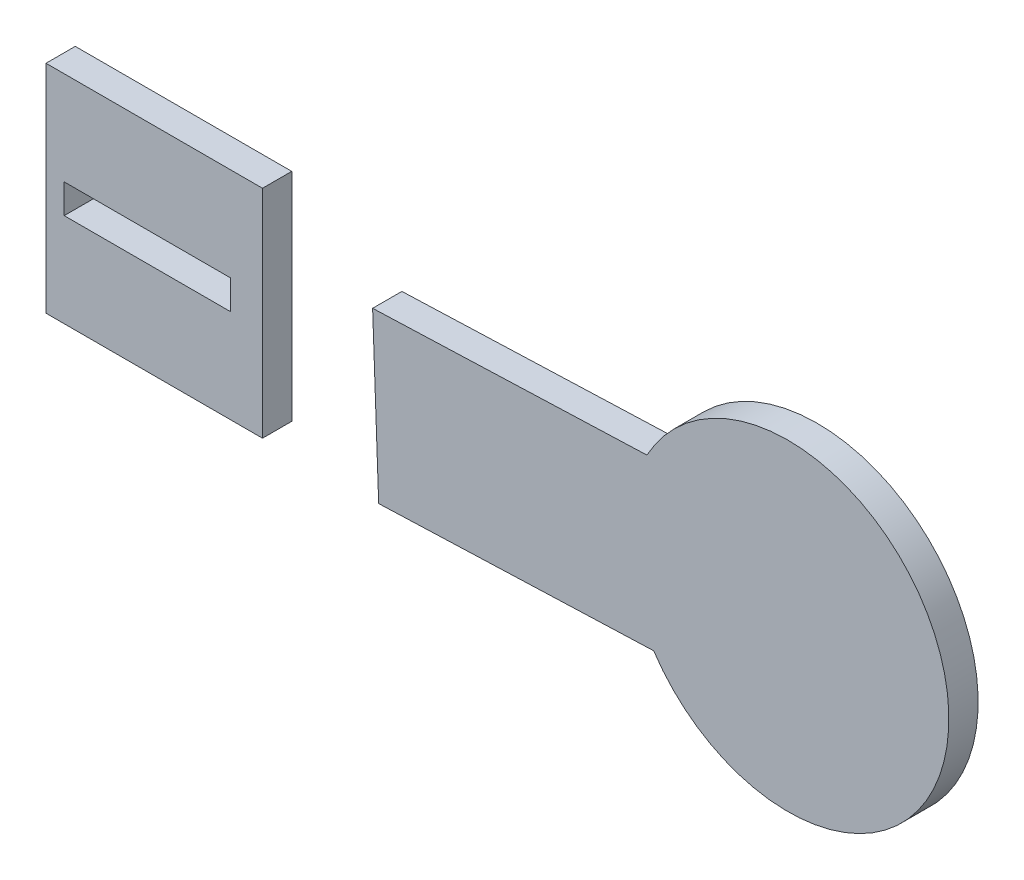
from build123d import *

# Parameters (mm, degrees)
ESQUISSE1_R        = 27.5
BOSS_EXTRU_1_DEPTH = 5
BOSS_EXTRU_2_START = -5
ESQUISSE2_W        = 37
ESQUISSE2_H        = 37
ESQUISSE2_W_2      = 28.39008226
ESQUISSE2_H_2      = 5
BOSS_EXTRU_2_DEPTH = 5


with BuildPart() as part:
    # Esquisse1 → Boss.-Extru.1 (new body)
    with BuildSketch(Plane.XY):
        with Locations((-60.40730743, 29.21875)):
            Circle(ESQUISSE1_R)
    extrude(amount=BOSS_EXTRU_1_DEPTH)

    # Esquisse2 → Boss.-Extru.2 (add)
    # profile 1 of 2: a face of its own
    with BuildSketch(Plane.XY.offset(5).offset(BOSS_EXTRU_2_START)):
        with BuildLine():
            Line((-83.35490173, 14.064281489), (-130.35490173, 12.348969386))
            Line((-130.35490173, 12.348969386), (-131.391026234, 40.739051645))
            Line((-131.391026234, 40.739051645), (-84.515157408, 42.449833457))
            ThreePointArc((-84.515157408, 42.449833457), (-32.930251562, 30.34187102), (-83.35490173, 14.064281489))
        make_face()
    # profile 2 of 2: a face of its own
    with BuildSketch(Plane.XY.offset(5).offset(BOSS_EXTRU_2_START)):
        with Locations((-168.711759769, 30.595460467)):
            Rectangle(ESQUISSE2_W, ESQUISSE2_H)
        with Locations((-169.906800899, 30.595460467)):
            Rectangle(ESQUISSE2_W_2, ESQUISSE2_H_2, mode=Mode.SUBTRACT)
    extrude(amount=BOSS_EXTRU_2_DEPTH)


with BuildPart() as boss_extru_2_piece_1:
    # of the separate pieces the step leaves, piece 1, a body of its own (boss_extru_2_pieces)
    add(part.part.solids().sort_by_distance((-83.35490173, 14.064281489, 0))[0])


with BuildPart() as boss_extru_2_piece_2:
    # of the separate pieces the step leaves, piece 2, a body of its own (boss_extru_2_pieces)
    add(part.part.solids().sort_by_distance((-150.211759769, 12.095460467, 0))[0])


solid = Compound([boss_extru_2_piece_1.part, boss_extru_2_piece_2.part])
